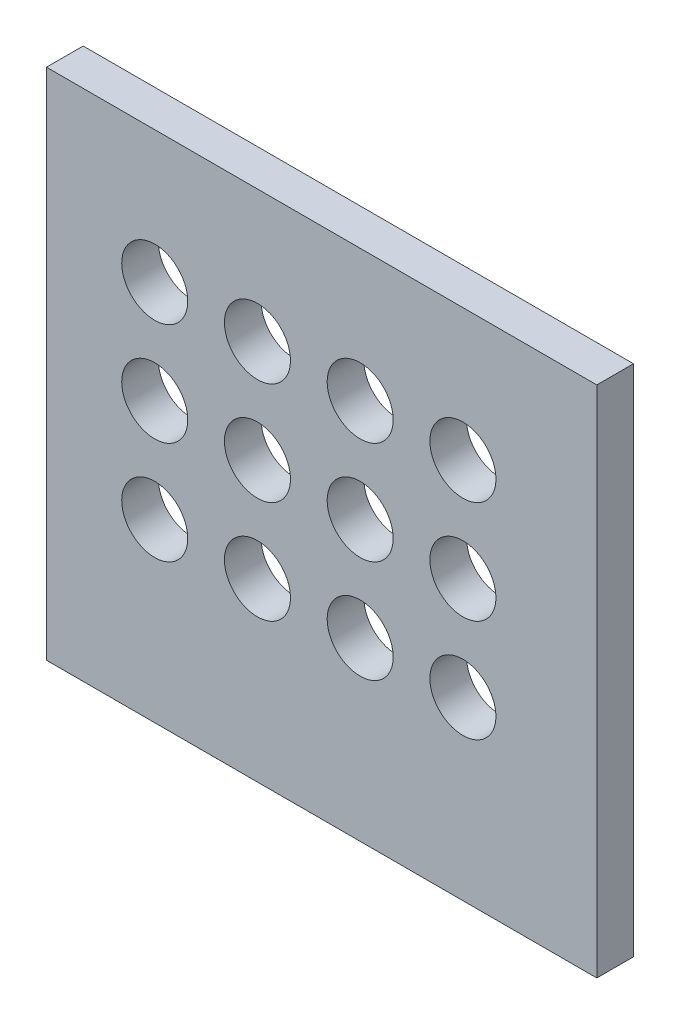
from build123d import *

# Parameters (mm, degrees)
SKETCH1_W           = 150
SKETCH1_H           = 140
SKETCH1_R           = 9
BOSS_EXTRUDE1_DEPTH = 10


with BuildPart() as part:
    # Sketch1 → Boss-Extrude1 (new body)
    with BuildSketch(Plane.XY.offset(10)):
        Rectangle(SKETCH1_W, SKETCH1_H)
        with Locations(Location((-17.5, -22, 0), (0, 0, 180))):
            Circle(SKETCH1_R, mode=Mode.SUBTRACT)
        with Locations(Location((-45.5, -22, 0), (0, 0, 180))):
            Circle(SKETCH1_R, mode=Mode.SUBTRACT)
        with Locations(Location((10.5, -22, 0), (0, 0, 180))):
            Circle(SKETCH1_R, mode=Mode.SUBTRACT)
        with Locations(Location((38.5, -22, 0), (0, 0, 180))):
            Circle(SKETCH1_R, mode=Mode.SUBTRACT)
        with Locations(Location((-45.5, 6, 0), (0, 0, 180))):
            Circle(SKETCH1_R, mode=Mode.SUBTRACT)
        with Locations(Location((-17.5, 6, 0), (0, 0, 180))):
            Circle(SKETCH1_R, mode=Mode.SUBTRACT)
        with Locations(Location((10.5, 6, 0), (0, 0, 180))):
            Circle(SKETCH1_R, mode=Mode.SUBTRACT)
        with Locations(Location((38.5, 6, 0), (0, 0, 180))):
            Circle(SKETCH1_R, mode=Mode.SUBTRACT)
        with Locations(Location((-45.5, 34, 0), (0, 0, 180))):
            Circle(SKETCH1_R, mode=Mode.SUBTRACT)
        with Locations(Location((-17.5, 34, 0), (0, 0, 180))):
            Circle(SKETCH1_R, mode=Mode.SUBTRACT)
        with Locations(Location((10.5, 34, 0), (0, 0, 180))):
            Circle(SKETCH1_R, mode=Mode.SUBTRACT)
        with Locations(Location((38.5, 34, 0), (0, 0, 180))):
            Circle(SKETCH1_R, mode=Mode.SUBTRACT)
    extrude(amount=-BOSS_EXTRUDE1_DEPTH)


solid = part.part
